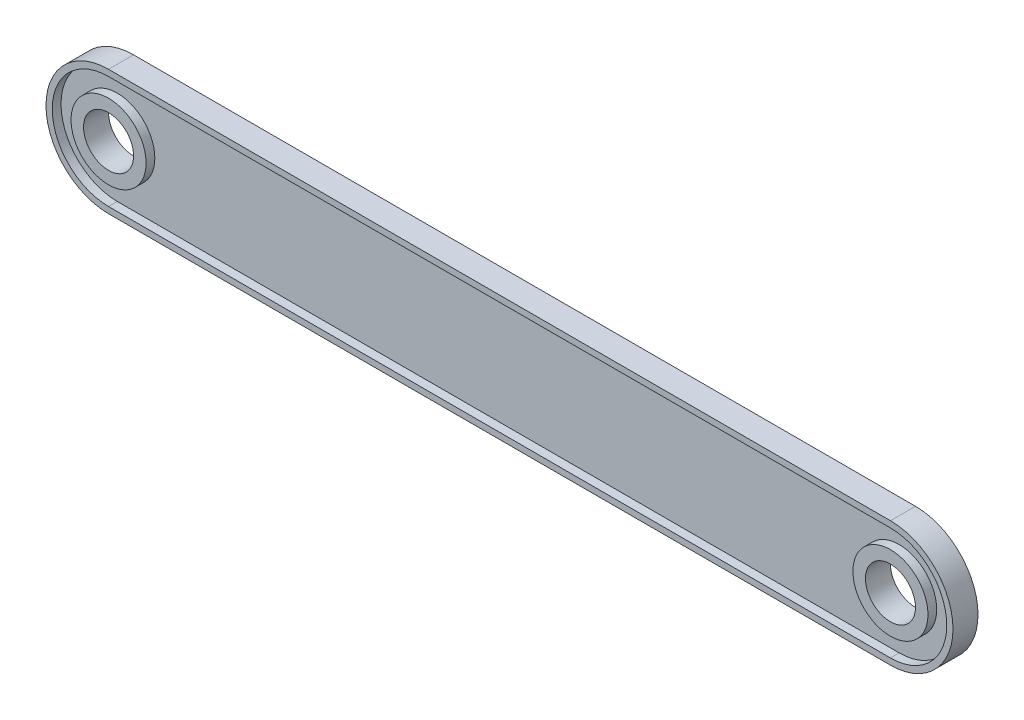
from build123d import *

# Parameters (mm, degrees)
SKETCH1_R           = 30
BOSS_EXTRUDE1_DEPTH = 3
SKETCH1_3_R         = 30
SKETCH1_3_R_2       = 20
BOSS_EXTRUDE2_DEPTH = 10


with BuildPart() as part:
    # Sketch1 → Boss-Extrude1 (new, symmetric)
    with BuildSketch(Plane.XY):
        with BuildLine():
            Line((625, 45), (0, 45))
            ThreePointArc((0, 45), (-45, 0), (0, -45))
            Line((0, -45), (625, -45))
            ThreePointArc((625, -45), (670, 0), (625, 45))
        make_face()
        Circle(SKETCH1_R, mode=Mode.SUBTRACT)
        with Locations((625, 0)):
            Circle(SKETCH1_R, mode=Mode.SUBTRACT)
    extrude(amount=BOSS_EXTRUDE1_DEPTH, both=True)

    # Sketch1<3> → Boss-Extrude2 (add, symmetric)
    # profile 1 of 3: a face of its own
    with BuildSketch(Plane.XY):
        with BuildLine():
            Line((625, 50), (0, 50))
            ThreePointArc((0, 50), (-50, 0), (0, -50))
            Line((0, -50), (625, -50))
            ThreePointArc((625, -50), (675, 0), (625, 50))
        make_face()
        with BuildLine():
            ThreePointArc((0, -45), (-45, 0), (0, 45))
            Line((0, 45), (625, 45))
            ThreePointArc((625, 45), (670, 0), (625, -45))
            Line((625, -45), (0, -45))
        make_face(mode=Mode.SUBTRACT)
    # profile 2 of 3: a face of its own
    with BuildSketch(Plane.XY):
        Circle(SKETCH1_3_R)
        Circle(SKETCH1_3_R_2, mode=Mode.SUBTRACT)
    # profile 3 of 3: a face of its own
    with BuildSketch(Plane.XY):
        with Locations((625, 0)):
            Circle(SKETCH1_3_R)
        with Locations((625, 0)):
            Circle(SKETCH1_3_R_2, mode=Mode.SUBTRACT)
    extrude(amount=BOSS_EXTRUDE2_DEPTH, both=True)


solid = part.part
